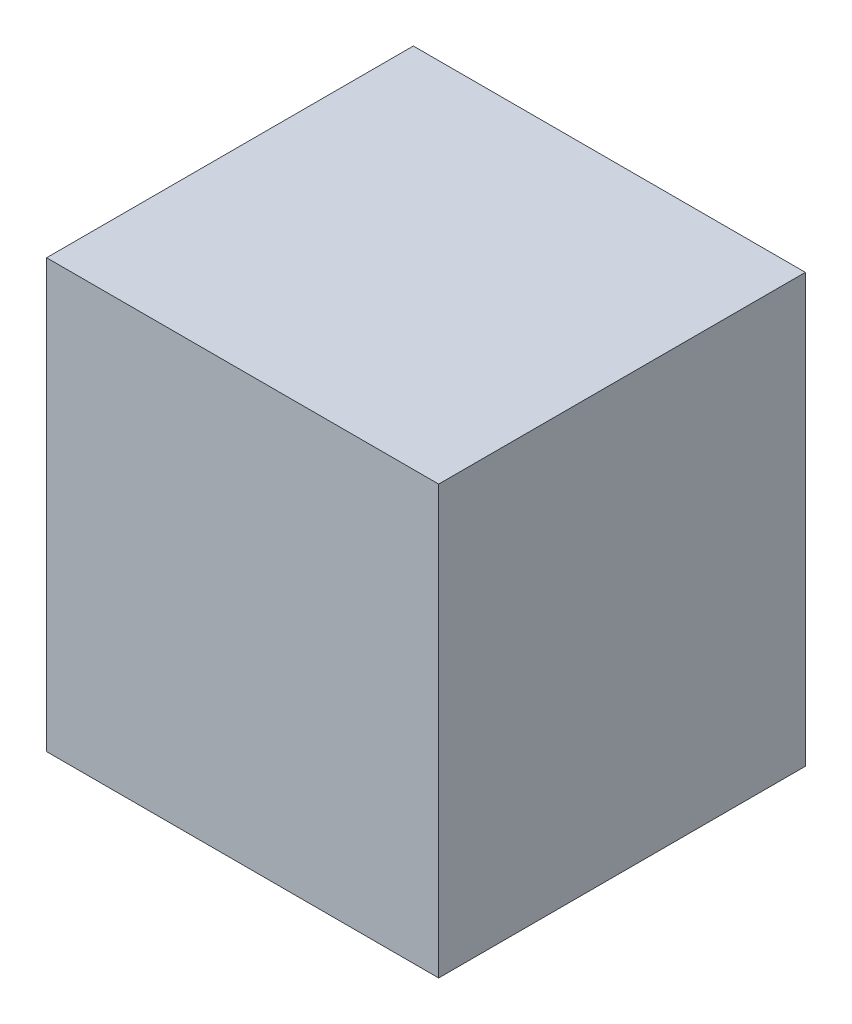
from build123d import *

# Parameters (mm, degrees)
BOSS_EXTRUDE1_DEPTH      = 4.978866735
BOSS_EXTRUDE1_DEPTH_BACK = 104.997590598
SKETCH1_W                = 119.988
SKETCH1_H                = 129.794
SKETCH3_OUTSIDE_W        = 153.613
SKETCH3_OUTSIDE_H        = 163.624
SKETCH3_OUTSIDE_R        = 4
CUT_EXTRUDE1_DEPTH       = 26.924
SKETCH4_R                = 2.8
CUT_EXTRUDE2_DEPTH       = 5


with BuildPart() as part:
    # Sketch1 → Boss-Extrude1 (new, two sides: drawn at the far end of the back side and taken through both)
    with BuildSketch(Plane.YZ.offset(-BOSS_EXTRUDE1_DEPTH_BACK)):
        with Locations((59.994, 64.897)):
            Rectangle(SKETCH1_W, SKETCH1_H)
    extrude(amount=BOSS_EXTRUDE1_DEPTH + BOSS_EXTRUDE1_DEPTH_BACK)

    # Sketch3 outside → Cut-Extrude1 (cut)
    with BuildSketch(Plane(origin=(0, 0, 0), x_dir=(1, 0, 0), z_dir=(0, 0, -1))):
        with Locations((-50.0095, -59.994)):
            Rectangle(SKETCH3_OUTSIDE_W, SKETCH3_OUTSIDE_H)
        with Locations(Location((-50.038, -59.994, 0), (0, 0, 180))):
            Circle(SKETCH3_OUTSIDE_R, mode=Mode.SUBTRACT)
    extrude(amount=-CUT_EXTRUDE1_DEPTH, mode=Mode.SUBTRACT)

    # Sketch4 → Cut-Extrude2 (cut)
    with BuildSketch(Plane.XZ):
        with Locations(Location((-97.538, 33.924, 0), (0, 0, 270))):
            Circle(SKETCH4_R)
        with Locations(Location((-97.538, 75.924, 0), (0, 0, 270))):
            Circle(SKETCH4_R)
        with Locations(Location((-2.480723862, 75.924, 0), (0, 0, 270))):
            Circle(SKETCH4_R)
        with Locations(Location((-2.480723862, 33.924, 0), (0, 0, 270))):
            Circle(SKETCH4_R)
    extrude(amount=-CUT_EXTRUDE2_DEPTH, mode=Mode.SUBTRACT)


solid = part.part
